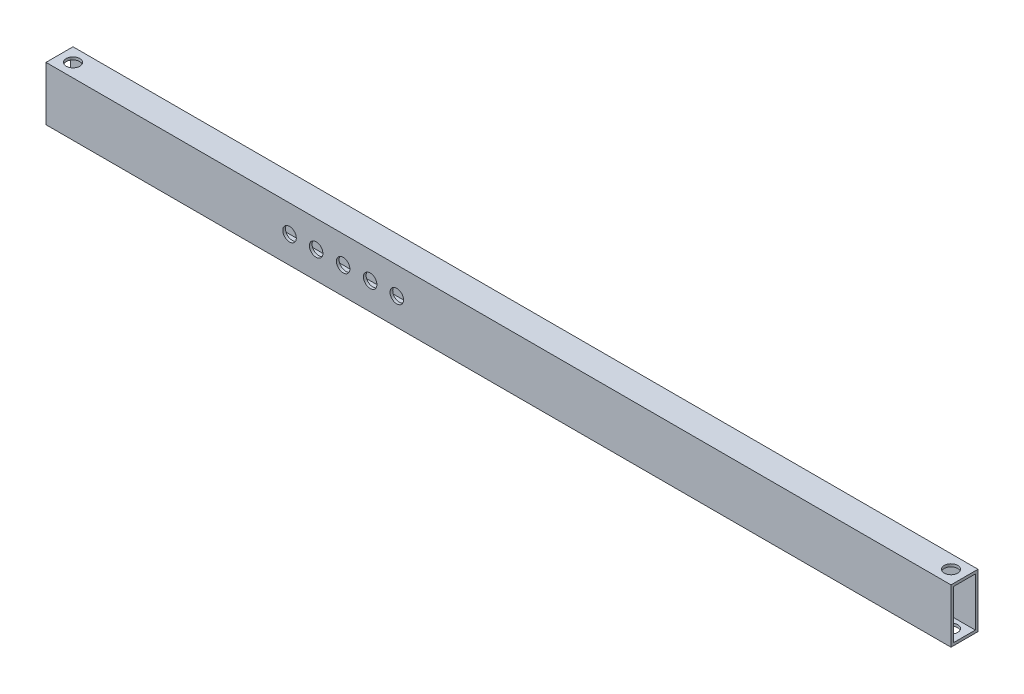
from build123d import *

# Parameters (mm, degrees)
BOSS_EXTRUDE1_DEPTH      = 225
BOSS_EXTRUDE1_DEPTH_BACK = 110
SKETCH1_W                = 10
SKETCH1_H                = 20
SKETCH1_W_2              = 8
SKETCH1_H_2              = 18
SKETCH2_R                = 2.5
CUT_EXTRUDE1_DEPTH       = 1
SKETCH3_R                = 2.5
CUT_EXTRUDE2_DEPTH       = 20


with BuildPart() as part:
    # Sketch1 → Boss-Extrude1 (new, two sides: drawn at the far end of the back side and taken through both)
    with BuildSketch(Plane(origin=(0, 0, 0), x_dir=(0, 0, -1), z_dir=(1, 0, 0)).offset(-BOSS_EXTRUDE1_DEPTH_BACK)):
        Rectangle(SKETCH1_W, SKETCH1_H)
        Rectangle(SKETCH1_W_2, SKETCH1_H_2, mode=Mode.SUBTRACT)
    extrude(amount=BOSS_EXTRUDE1_DEPTH + BOSS_EXTRUDE1_DEPTH_BACK)

    # Sketch2 → Cut-Extrude1 (cut)
    with BuildSketch(Plane.XY.offset(5)):
        with Locations((-19.85, 0)):
            Circle(SKETCH2_R)
        with Locations((-10, 0)):
            Circle(SKETCH2_R)
        Circle(SKETCH2_R)
        with Locations(Location((19.85, 0, 0), (0, 0, 180))):
            Circle(SKETCH2_R)
        with Locations(Location((10, 0, 0), (0, 0, 180))):
            Circle(SKETCH2_R)
    extrude(amount=-CUT_EXTRUDE1_DEPTH, mode=Mode.SUBTRACT)

    # Sketch3 → Cut-Extrude2 (cut)
    with BuildSketch(Plane(origin=(0, 10, 0), x_dir=(1, 0, 0), z_dir=(0, 1, 0))):
        with Locations(Location((220, 0, 0), (0, 0, 270))):
            Circle(SKETCH3_R)
        with Locations(Location((-105, 0, 0), (0, 0, 270))):
            Circle(SKETCH3_R)
    extrude(amount=-CUT_EXTRUDE2_DEPTH, mode=Mode.SUBTRACT)


solid = part.part
